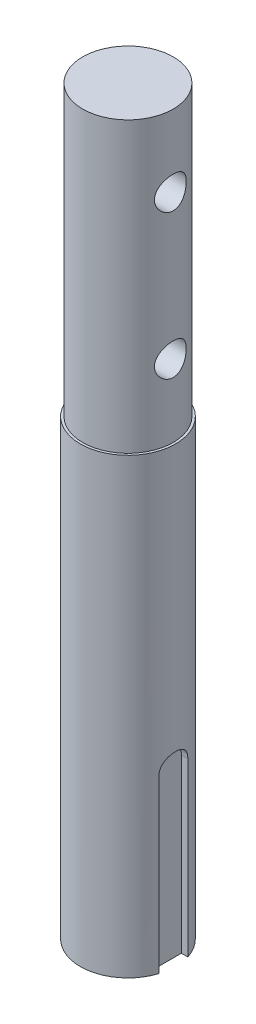
from build123d import *

# Parameters (mm, degrees)
SKETCH1_R               = 33
BOSS_EXTRUDE1_DEPTH     = 313.5
SKETCH2_R               = 31.34
BOSS_EXTRUDE2_DEPTH     = 200
CUT_EXTRUDE1_DEPTH      = 6
CUT_EXTRUDE2_DEPTH      = 516.616378729
CUT_EXTRUDE2_DEPTH_BACK = 516.616378729
SKETCH5_R               = 11


with BuildPart() as part:
    # Sketch1 → Boss-Extrude1 (new body)
    with BuildSketch(Plane(origin=(0, 0, 0), x_dir=(1, 0, 0), z_dir=(0, 1, 0))):
        with Locations(Location((0, 0, 0), (0, 0, 270))):
            Circle(SKETCH1_R)
    extrude(amount=BOSS_EXTRUDE1_DEPTH)

    # Sketch2 → Boss-Extrude2 (add)
    with BuildSketch(Plane(origin=(0, 313.5, 0), x_dir=(1, 0, 0), z_dir=(0, 1, 0))):
        with Locations(Location((0, 0, 0), (0, 0, 270))):
            Circle(SKETCH2_R)
    extrude(amount=BOSS_EXTRUDE2_DEPTH)

    # Sketch3 → Cut-Extrude1 (cut)
    with BuildSketch(Plane(origin=(33, 0, 0), x_dir=(0, 0, -1), z_dir=(1, 0, 0))):
        with BuildLine():
            Line((-10, 119), (-10, 0))
            Line((-10, 0), (10, 0))
            Line((10, 0), (10, 119))
            ThreePointArc((10, 119), (0, 129), (-10, 119))
        make_face()
    extrude(amount=-CUT_EXTRUDE1_DEPTH, mode=Mode.SUBTRACT)

    # Sketch5 → Cut-Extrude2 (cut, two sides: drawn at the far end of the back side and taken through both)
    with BuildSketch(Plane(origin=(0, 0, 0), x_dir=(0, 0, -1), z_dir=(1, 0, 0)).offset(-CUT_EXTRUDE2_DEPTH_BACK)):
        with Locations((0, 463.5)):
            Circle(SKETCH5_R)
        with Locations((0, 363.5)):
            Circle(SKETCH5_R)
    extrude(amount=CUT_EXTRUDE2_DEPTH + CUT_EXTRUDE2_DEPTH_BACK, mode=Mode.SUBTRACT)


solid = part.part
